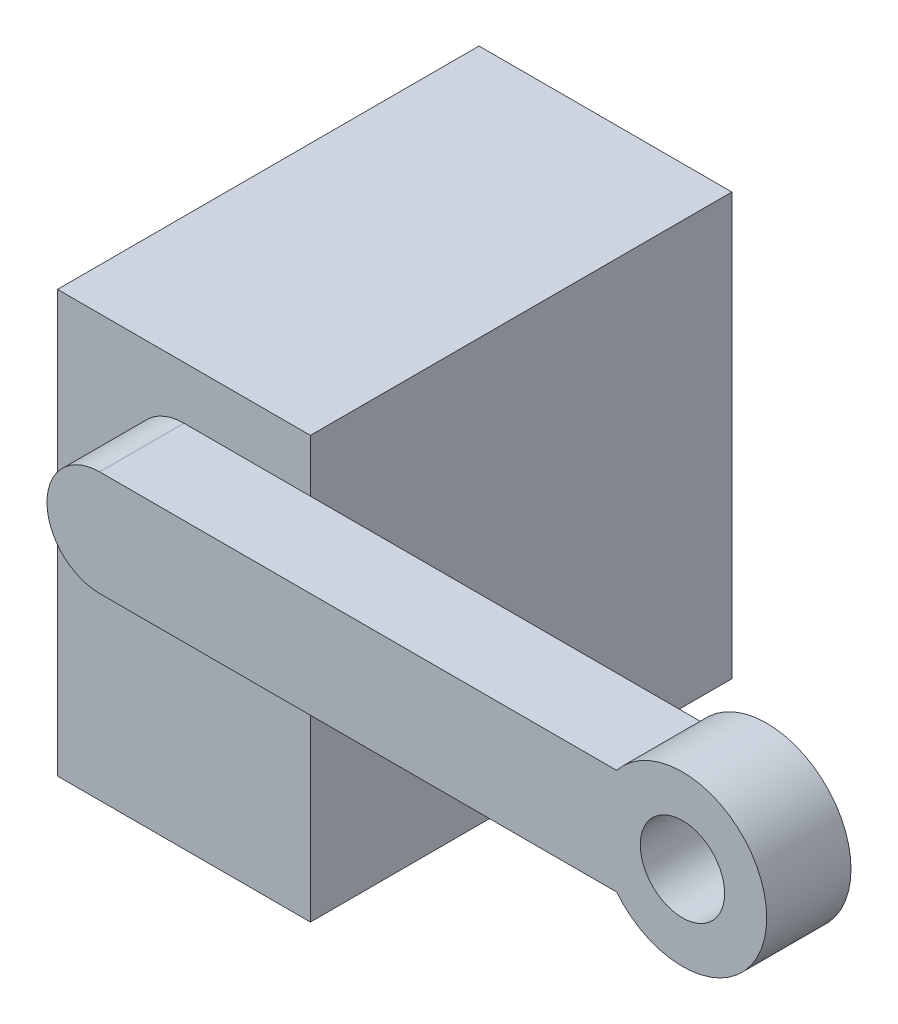
from build123d import *

# Parameters (mm, degrees)
ESQUISSE1_W        = 12
ESQUISSE1_H        = 20
BOSS_EXTRU_1_DEPTH = 20
ESQUISSE2_R        = 2
BOSS_EXTRU_2_DEPTH = 4


with BuildPart() as part:
    # Esquisse1 → Boss.-Extru.1 (new body)
    with BuildSketch(Plane.XY):
        Rectangle(ESQUISSE1_W, ESQUISSE1_H)
    extrude(amount=BOSS_EXTRU_1_DEPTH)

    # Esquisse2 → Boss.-Extru.2 (add)
    with BuildSketch(Plane.XY.offset(20)):
        with BuildLine():
            Line((0, 7.5), (24.528746791, 7.5))
            ThreePointArc((24.528746791, 7.5), (31.65124579, 5), (24.528746791, 2.5))
            Line((24.528746791, 2.5), (0, 2.5))
            ThreePointArc((0, 2.5), (-2.5, 5), (0, 7.5))
        make_face()
        with Locations((27.65124579, 5)):
            Circle(ESQUISSE2_R, mode=Mode.SUBTRACT)
    extrude(amount=BOSS_EXTRU_2_DEPTH)


solid = part.part
